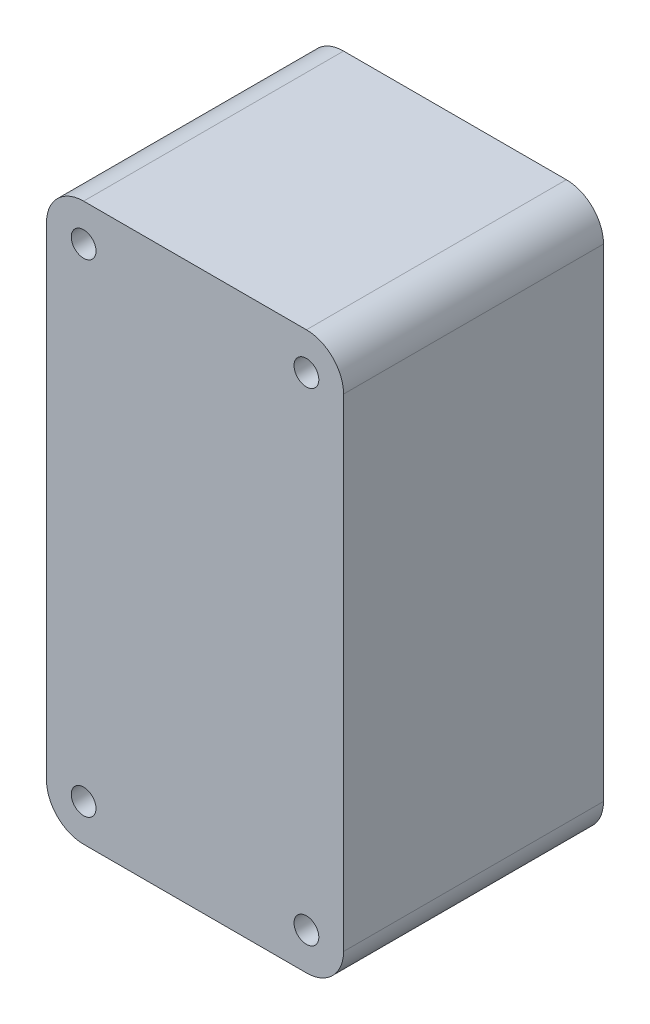
from build123d import *

# Parameters (mm, degrees)
BOSS_EXTRU_1_DEPTH       = 21
ESQUISSE2_R              = 1
ENL_V_MAT_EXTRU_7_DEPTH  = 4
ESQUISSE6_R              = 1
ENL_V_MAT_EXTRU_8_DEPTH  = 4
ESQUISSE7_R              = 1
ENL_V_MAT_EXTRU_9_DEPTH  = 4
ESQUISSE8_R              = 1
ENL_V_MAT_EXTRU_10_DEPTH = 4


with BuildPart() as part:
    # Esquisse1 → Boss.-Extru.1 (new body)
    with BuildSketch(Plane.XY):
        with BuildLine():
            Line((-28.419332535, 4.995952024), (-10.419332535, 4.995952024))
            ThreePointArc((-10.419332535, 4.995952024), (-8.298012191, 4.117272368), (-7.419332535, 1.995952024))
            Line((-7.419332535, 1.995952024), (-7.419332535, -37.004047976))
            ThreePointArc((-7.419332535, -37.004047976), (-8.298012191, -39.12536832), (-10.419332535, -40.004047976))
            Line((-10.419332535, -40.004047976), (-28.419332535, -40.004047976))
            ThreePointArc((-28.419332535, -40.004047976), (-30.540652878, -39.12536832), (-31.419332535, -37.004047976))
            Line((-31.419332535, -37.004047976), (-31.419332535, 1.995952024))
            ThreePointArc((-31.419332535, 1.995952024), (-30.540652878, 4.117272368), (-28.419332535, 4.995952024))
        make_face()
    extrude(amount=BOSS_EXTRU_1_DEPTH)

    # Esquisse2 → Enlèv. mat.-Extru.7 (cut)
    with BuildSketch(Plane.XY.offset(21)):
        with Locations((-28.419332535, -37.004047976)):
            Circle(ESQUISSE2_R)
    extrude(amount=-ENL_V_MAT_EXTRU_7_DEPTH, mode=Mode.SUBTRACT)

    # Esquisse6 → Enlèv. mat.-Extru.8 (cut)
    with BuildSketch(Plane.XY.offset(21)):
        with Locations((-10.419332535, -37.004047976)):
            Circle(ESQUISSE6_R)
    extrude(amount=-ENL_V_MAT_EXTRU_8_DEPTH, mode=Mode.SUBTRACT)

    # Esquisse7 → Enlèv. mat.-Extru.9 (cut)
    with BuildSketch(Plane.XY.offset(21)):
        with Locations((-28.419332535, 1.995952024)):
            Circle(ESQUISSE7_R)
    extrude(amount=-ENL_V_MAT_EXTRU_9_DEPTH, mode=Mode.SUBTRACT)

    # Esquisse8 → Enlèv. mat.-Extru.10 (cut)
    with BuildSketch(Plane.XY.offset(21)):
        with Locations((-10.419332535, 1.995952024)):
            Circle(ESQUISSE8_R)
    extrude(amount=-ENL_V_MAT_EXTRU_10_DEPTH, mode=Mode.SUBTRACT)


solid = part.part
